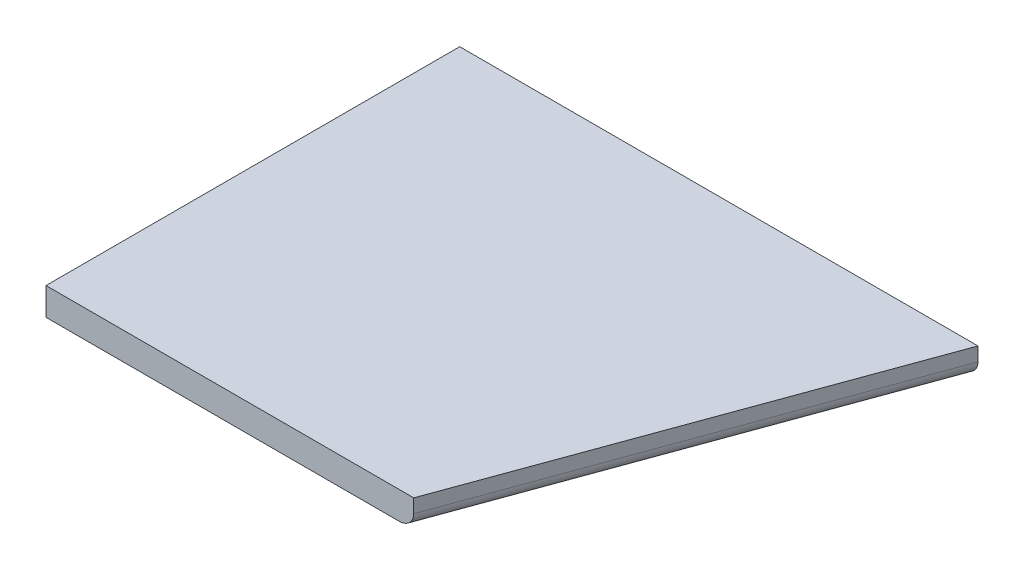
from build123d import *

# Parameters (mm, degrees)
BOSS_EXTRUDE1_DEPTH = 6
FILLET1_R           = 3


with BuildPart() as part:
    # Sketch1 → Boss-Extrude1 (new body)
    with BuildSketch(Plane(origin=(0, 0, 0), x_dir=(1, 0, 0), z_dir=(0, 1, 0))):
        Polygon((0, 0), (32.757321084, 90), (0, 90), (-80, 90), (-80, 0), align=None)
    extrude(amount=BOSS_EXTRUDE1_DEPTH)

    # Fillet1
    fillet1_edges = [part.edges().sort_by_distance(p)[0] for p in [
        (16.378660542, 0, -45),
    ]]
    fillet(fillet1_edges, radius=FILLET1_R)


solid = part.part
